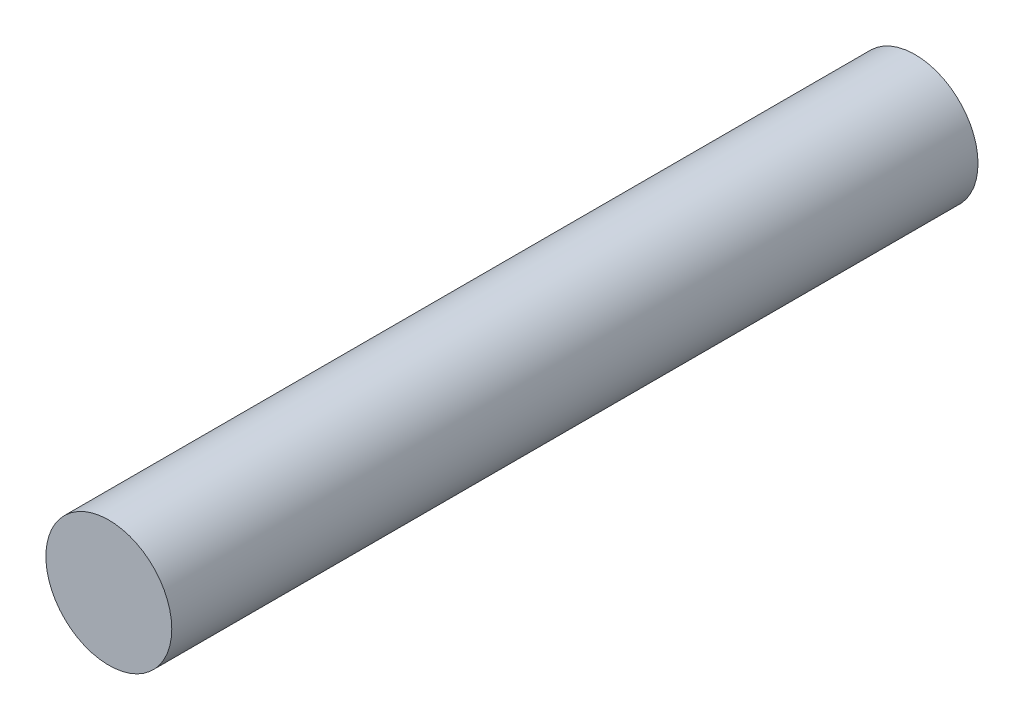
from build123d import *

# Parameters (mm, degrees)
SKETCH2_R           = 1.1303
BOSS_EXTRUDE1_DEPTH = 14.478


with BuildPart() as part:
    # Sketch2 → Boss-Extrude1 (new body)
    with BuildSketch(Plane.XY):
        Circle(SKETCH2_R)
    extrude(amount=BOSS_EXTRUDE1_DEPTH)


solid = part.part
